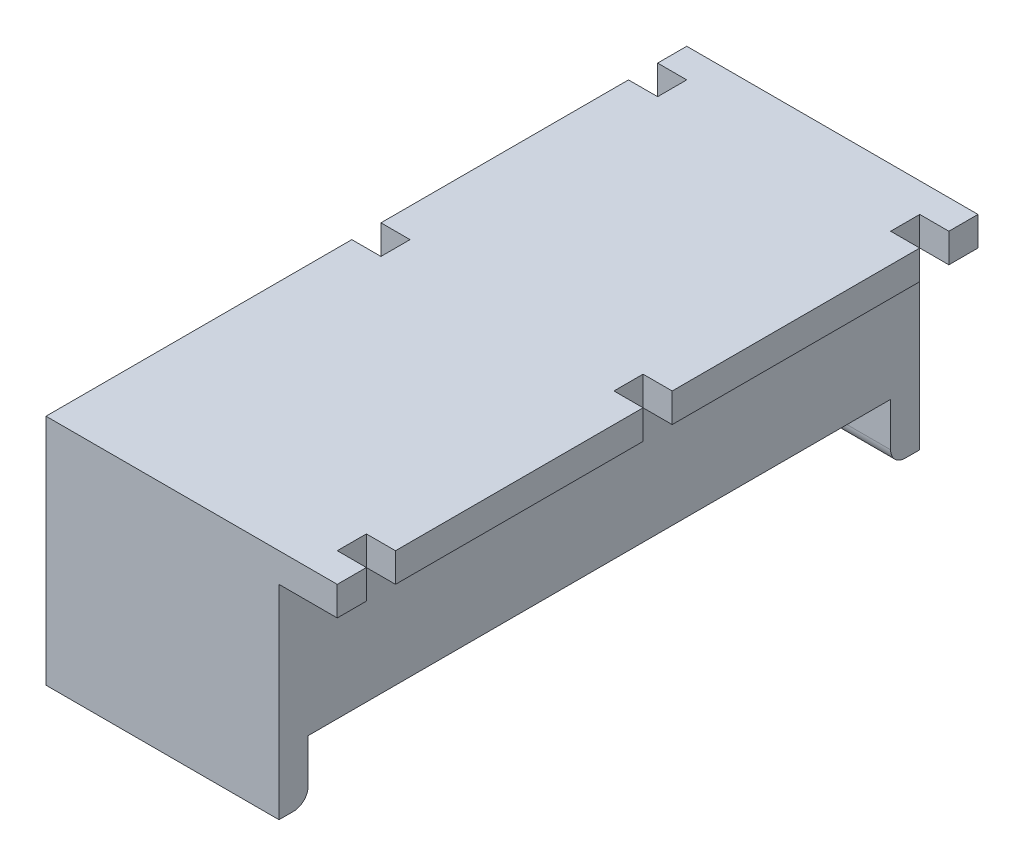
from build123d import *

# Parameters (mm, degrees)
SKETCH2_W           = 50
SKETCH2_H           = 110
SKETCH2_W_2         = 40
SKETCH2_H_2         = 100
BOSS_EXTRUDE1_DEPTH = 30
SKETCH2_4_W         = 40
SKETCH2_4_H         = 100
BOSS_EXTRUDE2_DEPTH = 5
CUT_EXTRUDE2_DEPTH  = 25
BOSS_EXTRUDE3_DEPTH = 25
SKETCH10_W          = 40
SKETCH10_H          = 5
BOSS_EXTRUDE4_DEPTH = 35
SKETCH11_W          = 5
SKETCH11_H          = 5
CUT_EXTRUDE5_DEPTH  = 6
SKETCH11_4_W        = 5
SKETCH11_4_H        = 5
CUT_EXTRUDE6_DEPTH  = 4.99
FILLET1_R           = 2.5
CUT_EXTRUDE8_DEPTH  = 5


with BuildPart() as part:
    # Sketch2 → Boss-Extrude1 (new body)
    with BuildSketch(Plane(origin=(0, 0, 0), x_dir=(1, 0, 0), z_dir=(0, 1, 0))):
        with Locations((2.5, 5)):
            Rectangle(SKETCH2_W, SKETCH2_H)
        with Locations((2.5, 5)):
            Rectangle(SKETCH2_W_2, SKETCH2_H_2, mode=Mode.SUBTRACT)
    extrude(amount=-BOSS_EXTRUDE1_DEPTH)

    # Sketch2<4> → Boss-Extrude2 (add)
    with BuildSketch(Plane(origin=(0, 0, 0), x_dir=(1, 0, 0), z_dir=(0, 1, 0))):
        with Locations((2.5, 5)):
            Rectangle(SKETCH2_4_W, SKETCH2_4_H)
    extrude(amount=-BOSS_EXTRUDE2_DEPTH)

    # Sketch5 → Cut-Extrude2 (cut)
    with BuildSketch(Plane.XZ.offset(30)):
        Polygon((27.5, 50), (-22.5, 50), (-22.5, 45), (-17.5, 45), (17.5, 45), (22.5, 45), (22.5, -55), (17.5, -55), (-17.5, -55), (-22.5, -55), (-22.5, -60), (27.5, -60), align=None)
    extrude(amount=-CUT_EXTRUDE2_DEPTH, mode=Mode.SUBTRACT)

    # Sketch5<3> → Boss-Extrude3 (add)
    with BuildSketch(Plane.XZ.offset(30)):
        Polygon((17.5, 45), (-17.5, 45), (-17.5, 40), (12.5, 40), (12.5, -50), (-17.5, -50), (-17.5, -55), (17.5, -55), align=None)
    extrude(amount=-BOSS_EXTRUDE3_DEPTH)

    # Sketch10 → Boss-Extrude4 (add)
    with BuildSketch(Plane.XZ.offset(5)):
        with Locations((-2.5, 47.5)):
            Rectangle(SKETCH10_W, SKETCH10_H)
        with Locations((-2.5, -57.5)):
            Rectangle(SKETCH10_W, SKETCH10_H)
    extrude(amount=BOSS_EXTRUDE4_DEPTH)

    # Sketch11 → Cut-Extrude5 (cut)
    with BuildSketch(Plane(origin=(0, 0, 0), x_dir=(1, 0, 0), z_dir=(0, 1, 0))):
        with Locations((25, 52.5)):
            Rectangle(SKETCH11_W, SKETCH11_H)
        with Locations((25, 5)):
            Rectangle(SKETCH11_W, SKETCH11_H)
        with Locations((25, -42.5)):
            Rectangle(SKETCH11_W, SKETCH11_H)
    extrude(amount=-CUT_EXTRUDE5_DEPTH, mode=Mode.SUBTRACT)

    # Sketch11<4> → Cut-Extrude6 (cut)
    with BuildSketch(Plane(origin=(0, 0, 0), x_dir=(1, 0, 0), z_dir=(0, 1, 0))):
        with Locations((-20, 52.5)):
            Rectangle(SKETCH11_4_W, SKETCH11_4_H)
        with Locations((-20, 5)):
            Rectangle(SKETCH11_4_W, SKETCH11_4_H)
    extrude(amount=-CUT_EXTRUDE6_DEPTH, mode=Mode.SUBTRACT)

    # Fillet1
    fillet1_edges = [part.edges().sort_by_distance(p)[0] for p in [
        (-2.5, -40, -55),
        (-2.5, -40, 45),
    ]]
    fillet(fillet1_edges, radius=FILLET1_R)

    # Sketch3 → Cut-Extrude8 (cut)
    with BuildSketch(Plane.ZY.offset(22.5)):
        Polygon((23, -22), (20, -22), (17, -22), (17, -28), (23, -28), align=None)
    extrude(amount=-CUT_EXTRUDE8_DEPTH, mode=Mode.SUBTRACT)


solid = part.part
